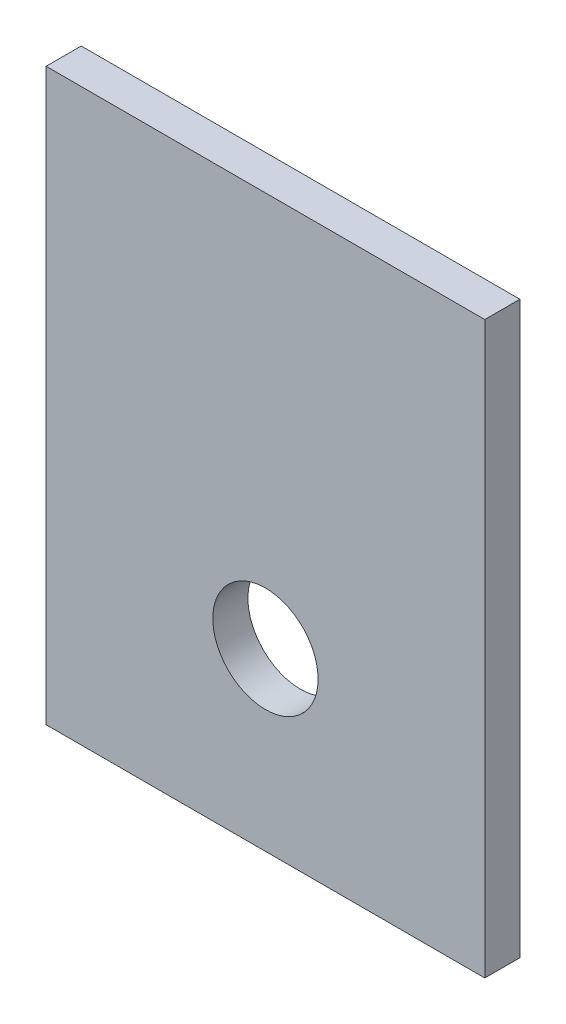
from build123d import *

# Parameters (mm, degrees)
SKETCH2_W           = 50
SKETCH2_H           = 90
BOSS_EXTRUDE1_DEPTH = 4
SKETCH3_R           = 6
CUT_EXTRUDE1_DEPTH  = 4
SKETCH4_W           = 50
SKETCH4_H           = 25
CUT_EXTRUDE2_DEPTH  = 10


with BuildPart() as part:
    # Sketch2 → Boss-Extrude1 (new body)
    with BuildSketch(Plane.XY):
        Rectangle(SKETCH2_W, SKETCH2_H)
    extrude(amount=BOSS_EXTRUDE1_DEPTH)

    # Sketch3 → Cut-Extrude1 (cut)
    with BuildSketch(Plane.XY.offset(4)):
        with Locations((0, -25)):
            Circle(SKETCH3_R)
    extrude(amount=-CUT_EXTRUDE1_DEPTH, mode=Mode.SUBTRACT)

    # Sketch4 → Cut-Extrude2 (cut)
    with BuildSketch(Plane.XY.offset(4)):
        with Locations((0, 32.5)):
            Rectangle(SKETCH4_W, SKETCH4_H)
    extrude(amount=-CUT_EXTRUDE2_DEPTH, mode=Mode.SUBTRACT)


solid = part.part
